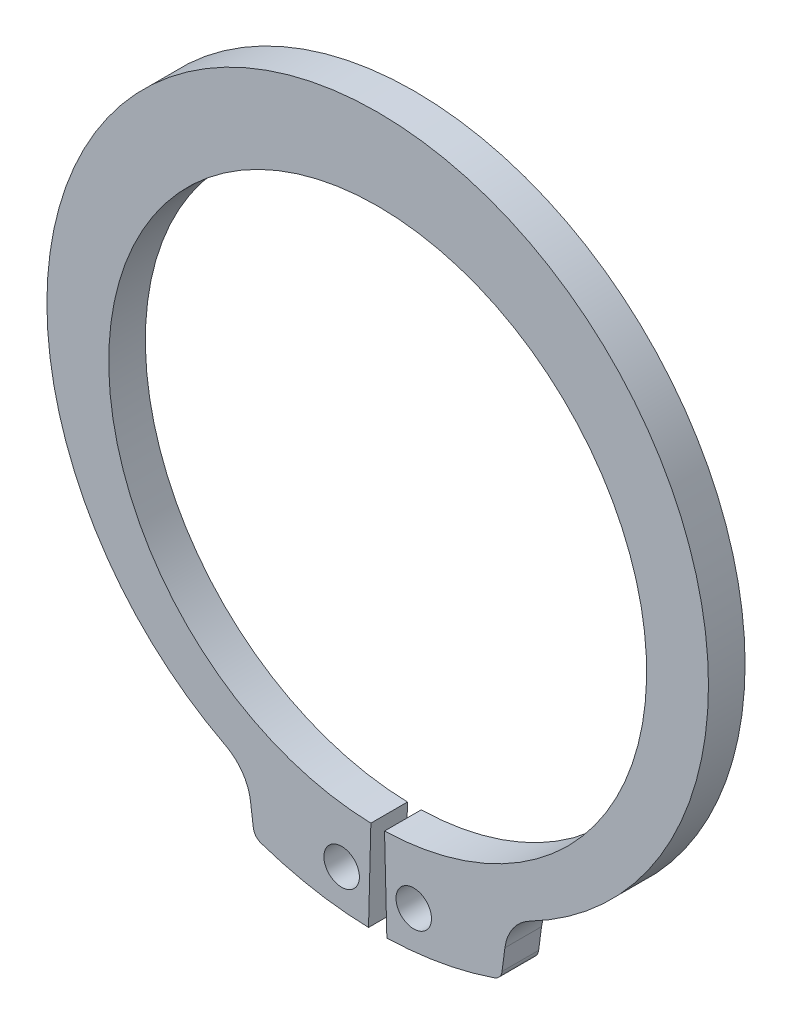
from build123d import *

# Parameters (mm, degrees)
BODYSKE_R  = 1.55
BODY_DEPTH = 3.2


with BuildPart() as part:
    # BodySke → Body (new body)
    with BuildSketch(Plane.XY):
        with BuildLine():
            Line((0.596825397, -23.492420042), (0.8, -31.489839631))
            ThreePointArc((0.8, -31.489839631), (5.561851931, -31.00509318), (10.195285406, -29.804465361))
            ThreePointArc((10.195285406, -29.804465361), (10.645379542, -29.491778056), (10.863070413, -28.98881805))
            Line((10.863070413, -28.98881805), (11.116180935, -27.066252766))
            ThreePointArc((11.116180935, -27.066252766), (11.824648845, -25.247081747), (13.294332949, -23.962037541))
            ThreePointArc((13.294332949, -23.962037541), (0, 30.6), (-13.294332949, -23.962037541))
            ThreePointArc((-13.294332949, -23.962037541), (-11.824648845, -25.247081747), (-11.116180935, -27.066252766))
            Line((-11.116180935, -27.066252766), (-10.863070413, -28.98881805))
            ThreePointArc((-10.863070413, -28.98881805), (-10.645379542, -29.491778056), (-10.195285406, -29.804465361))
            ThreePointArc((-10.195285406, -29.804465361), (-5.561851931, -31.00509318), (-0.8, -31.489839631))
            Line((-0.8, -31.489839631), (-0.596825397, -23.492420042))
            ThreePointArc((-0.596825397, -23.492420042), (0, 23.5), (0.596825397, -23.492420042))
        make_face()
        with Locations((3.15, -28.073831231)):
            Circle(BODYSKE_R, mode=Mode.SUBTRACT)
        with Locations((-3.15, -28.073831231)):
            Circle(BODYSKE_R, mode=Mode.SUBTRACT)
    extrude(amount=-BODY_DEPTH)


solid = part.part
